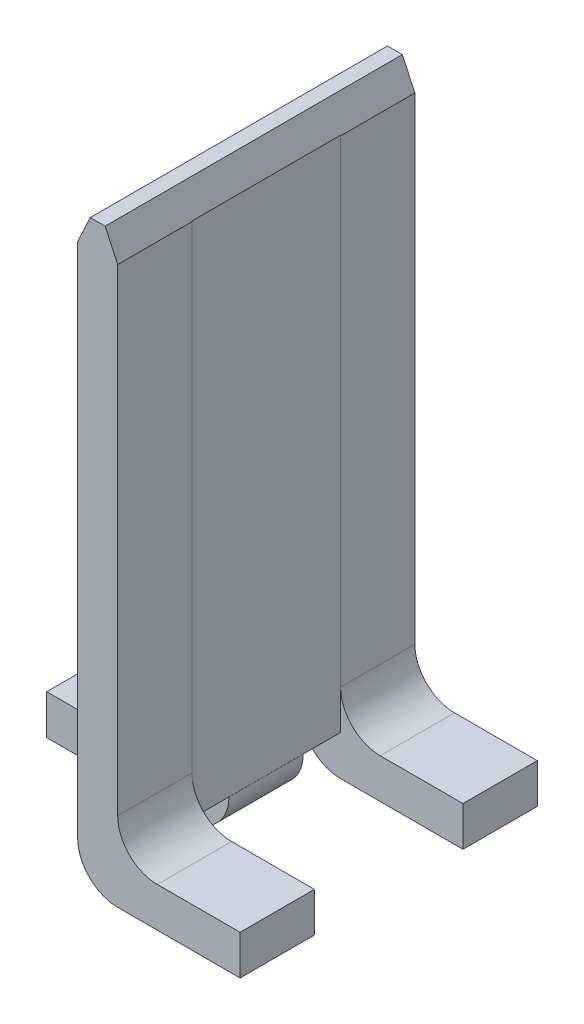
from build123d import *

# Parameters (mm, degrees)
BOSS_EXTRUDE1_DEPTH = 6.096
SKETCH2_W           = 3.048
SKETCH2_H           = 0.816265766
CUT_EXTRUDE1_DEPTH  = 10.169833116
SKETCH3_W           = 1.524
SKETCH3_H           = 0.816265766
BOSS_EXTRUDE2_DEPTH = 2.921
BOSS_EXTRUDE3_DEPTH = 1.524
SKETCH7_W           = 0.741832356
SKETCH7_H           = 3.048
CUT_EXTRUDE3_DEPTH  = 14.141059814


with BuildPart() as part:
    # Sketch1 → Boss-Extrude1 (new body)
    with BuildSketch(Plane.XY):
        with BuildLine():
            Line((0.410410125, 5.432205501), (0.1524, 5.98551))
            Line((0.1524, 5.98551), (-0.1524, 5.98551))
            Line((-0.1524, 5.98551), (-0.410410125, 5.432205501))
            Line((-0.410410125, 5.432205501), (-0.410410125, -5.169217411))
            ThreePointArc((-0.410410125, -5.169217411), (-0.169813529, -5.745269384), (0.406398179, -5.985483177))
            Line((0.406398179, -5.985483177), (2.921, -5.985483177))
            Line((2.921, -5.985483177), (2.921, -5.172683177))
            Line((2.921, -5.172683177), (1.223210125, -5.172683177))
            ThreePointArc((1.223210125, -5.172683177), (0.648473733, -4.934619569), (0.410410125, -4.359883177))
            Line((0.410410125, -4.359883177), (0.410410125, 5.432205501))
        make_face()
    extrude(amount=BOSS_EXTRUDE1_DEPTH)

    # Sketch2 → Cut-Extrude1 (cut, through all)
    with BuildSketch(Plane.ZY.offset(0.410410125)):
        with Locations((3.048, -5.577350294)):
            Rectangle(SKETCH2_W, SKETCH2_H)
    extrude(amount=-CUT_EXTRUDE1_DEPTH, mode=Mode.SUBTRACT)


with BuildPart() as body_2:
    # Sketch3 → Boss-Extrude2 (new body)
    with BuildSketch(Plane.ZY.offset(0.410410125)):
        with Locations((3.048, -5.577350294)):
            Rectangle(SKETCH3_W, SKETCH3_H)
    extrude(amount=BOSS_EXTRUDE2_DEPTH)


with BuildPart() as boss_extrude3_tool:
    # Sketch4 → Boss-Extrude3 (new body)
    with BuildSketch(Plane.XY.offset(3.81)):
        with BuildLine():
            Line((-1.223210125, -5.169217411), (-1.223210125, -5.985483177))
            Line((-1.223210125, -5.985483177), (-0.410410125, -5.985483177))
            ThreePointArc((-0.410410125, -5.985483177), (0.166164352, -5.747016402), (0.405853805, -5.170949135))
            Line((0.405853805, -5.170949135), (-0.410410125, -5.169217411))
            Line((-0.410410125, -5.169217411), (-0.410411954, -4.358141783))
            ThreePointArc((-0.410411954, -4.358141783), (-0.649083714, -4.931763137), (-1.223210125, -5.169217411))
        make_face()
    extrude(amount=-BOSS_EXTRUDE3_DEPTH)


with BuildPart() as part_1:
    add(part.part)


with BuildPart() as part_2:
    # Boss-Extrude3: joined with boss_extrude3_tool
    add(part_1.part.fuse(boss_extrude3_tool.part, body_2.part, tol=0.00001))

    # Sketch7 → Cut-Extrude3 (cut, through all)
    with BuildSketch(Plane.XZ.offset(5.169217411)):
        with Locations((0.777314357, 3.048)):
            Rectangle(SKETCH7_W, SKETCH7_H)
    extrude(amount=-CUT_EXTRUDE3_DEPTH, mode=Mode.SUBTRACT)


solid = part_2.part
